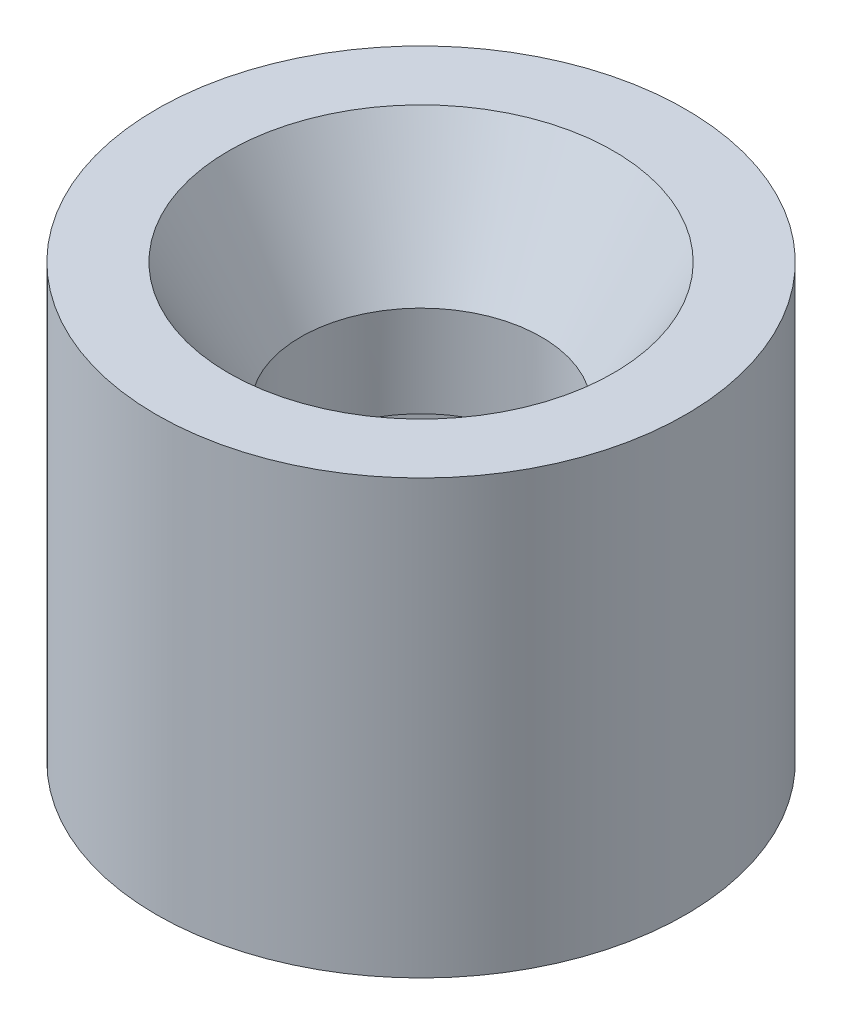
from build123d import *

# Parameters (mm, degrees)
SKETCH1_R                                           = 6.985
BOSS_EXTRUDE1_DEPTH                                 = 11.43
CSK_FOR_1_4_FLAT_HEAD_MACHINE_SCREW_100_D           = 6.35
CSK_FOR_1_4_FLAT_HEAD_MACHINE_SCREW_100_CSINK_D     = 10.16
CSK_FOR_1_4_FLAT_HEAD_MACHINE_SCREW_100_CSINK_ANGLE = 60
CUT_EXTRUDE1_DEPTH                                  = 5.715


with BuildPart() as part:
    # Sketch1 → Boss-Extrude1 (new body)
    with BuildSketch(Plane(origin=(0, 0, 0), x_dir=(1, 0, 0), z_dir=(0, 1, 0))):
        with Locations(Location((0, 0, 0), (0, 0, 270))):
            Circle(SKETCH1_R)
    extrude(amount=BOSS_EXTRUDE1_DEPTH)

    # CSK for 1/4 Flat Head Machine Screw (100)1 (through all)
    with Locations(Plane(origin=(0, 11.43, 0), x_dir=(1, 0, 0), z_dir=(0, 1, 0))):
        with Locations((0, 0)):
            CounterSinkHole(CSK_FOR_1_4_FLAT_HEAD_MACHINE_SCREW_100_D / 2, CSK_FOR_1_4_FLAT_HEAD_MACHINE_SCREW_100_CSINK_D / 2, counter_sink_angle=CSK_FOR_1_4_FLAT_HEAD_MACHINE_SCREW_100_CSINK_ANGLE)

    # Sketch4 → Cut-Extrude1 (cut)
    with BuildSketch(Plane.XZ):
        Polygon((5.43794625, -3.738588047), (5.956685348, 2.840105573), (0.518739098, 6.57869362), (-5.43794625, 3.738588047), (-5.956685348, -2.840105573), (-0.518739098, -6.57869362), align=None)
    extrude(amount=-CUT_EXTRUDE1_DEPTH, mode=Mode.SUBTRACT)


solid = part.part
